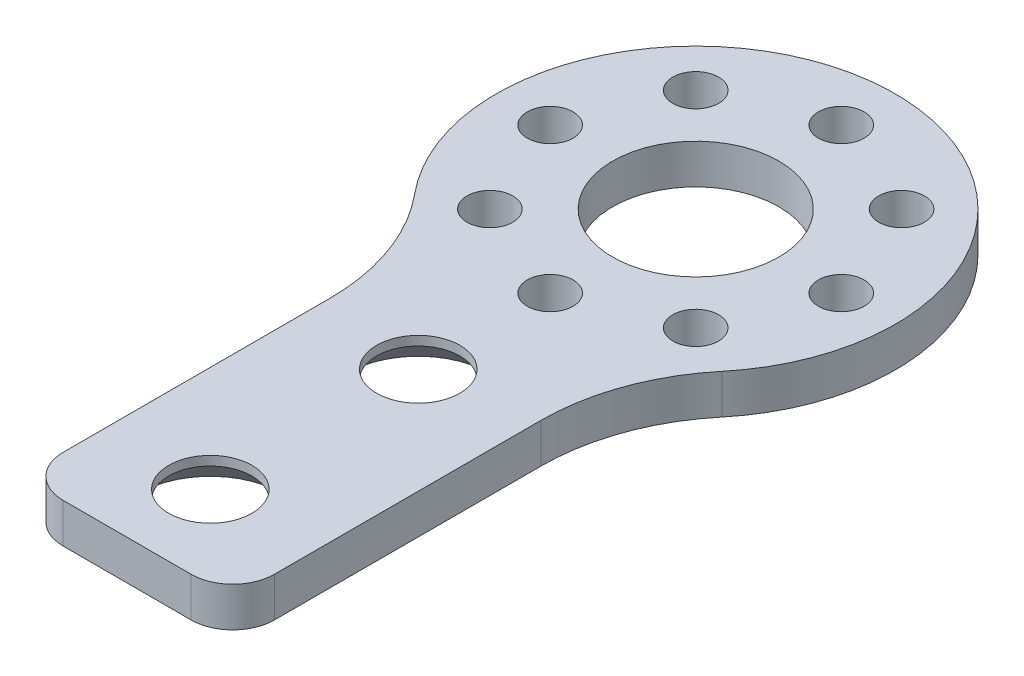
from build123d import *

# Parameters (mm, degrees)
BOSS_EXTRUDE1_DEPTH                            = 4.7625
M5_CLEARANCE_HOLE1_D                           = 5.5
M5_CLEARANCE_HOLE1_CSINK_D                     = 5.55
M5_CLEARANCE_HOLE1_CSINK_ANGLE                 = 90
SKETCH5_R                                      = 10
CUT_EXTRUDE1_DEPTH                             = 73.611133199
CSK_FOR_M8_FLAT_HEAD_MACHINE_SCREW1_AT_2_COUNT = 2
CSK_FOR_M8_FLAT_HEAD_MACHINE_SCREW1_AT_2_PITCH = 25
FILLET1_R                                      = 25
FILLET2_R                                      = 5


with BuildPart() as part:
    # Sketch1 → Boss-Extrude1 (new body)
    with BuildSketch(Plane(origin=(0, 0, 0), x_dir=(1, 0, 0), z_dir=(0, 1, 0))):
        with BuildLine():
            Line((-12.7, -68.364429774), (12.7, -68.364429774))
            Line((12.7, -68.364429774), (12.7, -20.364429774))
            ThreePointArc((12.7, -20.364429774), (0, 24), (-12.7, -20.364429774))
            Line((-12.7, -20.364429774), (-12.7, -68.364429774))
        make_face()
    extrude(amount=BOSS_EXTRUDE1_DEPTH)

    # M5 Clearance Hole1 (through all)
    with Locations(Plane(origin=(0, 0, 0), x_dir=(-1, 0, 0), z_dir=(0, -1, 0))):
        with Locations((0, 17.5), (12.374368671, 12.374368671), (17.5, 0), (12.374368671, -12.374368671), (0, -17.5), (-12.374368671, -12.374368671), (-17.5, 0), (-12.374368671, 12.374368671)):
            CounterSinkHole(M5_CLEARANCE_HOLE1_D / 2, M5_CLEARANCE_HOLE1_CSINK_D / 2, counter_sink_angle=M5_CLEARANCE_HOLE1_CSINK_ANGLE)

    # Sketch5 → Cut-Extrude1 (cut, through all)
    with BuildSketch(Plane.XZ):
        with Locations(Location((0, 0, 0), (0, 0, 270))):
            Circle(SKETCH5_R)
    extrude(amount=-CUT_EXTRUDE1_DEPTH, mode=Mode.SUBTRACT)

    # Sketch8 → CSK for M8 Flat Head Machine Screw1 (revolve, cut)
    with BuildSketch(Plane(origin=(0, 0, 33.364429774), x_dir=(0, 0, -1), z_dir=(1, 0, 0))):
        Polygon((0, 0), (0, 4.7625), (5, 4.7625), (5, 3.65), (8.65, 0), align=None)
    csk_for_m8_flat_head_machine_screw1 = revolve(axis=Axis((0, -6.35, 33.364429774), (0, 1, 0)), mode=Mode.SUBTRACT)

    # CSK for M8 Flat Head Machine Screw1 at 2: CSK for M8 Flat Head Machine Screw1 ×2
    with Locations(*[(0, 0, i * CSK_FOR_M8_FLAT_HEAD_MACHINE_SCREW1_AT_2_PITCH) for i in range(1, CSK_FOR_M8_FLAT_HEAD_MACHINE_SCREW1_AT_2_COUNT)]):
        add(csk_for_m8_flat_head_machine_screw1, mode=Mode.SUBTRACT)

    # Fillet1
    fillet1_edges = [part.edges().sort_by_distance(p)[0] for p in [
        (-12.7, 2.38125, 20.364429774),
        (12.7, 2.38125, 20.364429774),
    ]]
    fillet(fillet1_edges, radius=FILLET1_R)

    # Fillet2
    fillet2_edges = [part.edges().sort_by_distance(p)[0] for p in [
        (12.7, 2.38125, 68.364429774),
        (-12.7, 2.38125, 68.364429774),
    ]]
    fillet(fillet2_edges, radius=FILLET2_R)


solid = part.part
